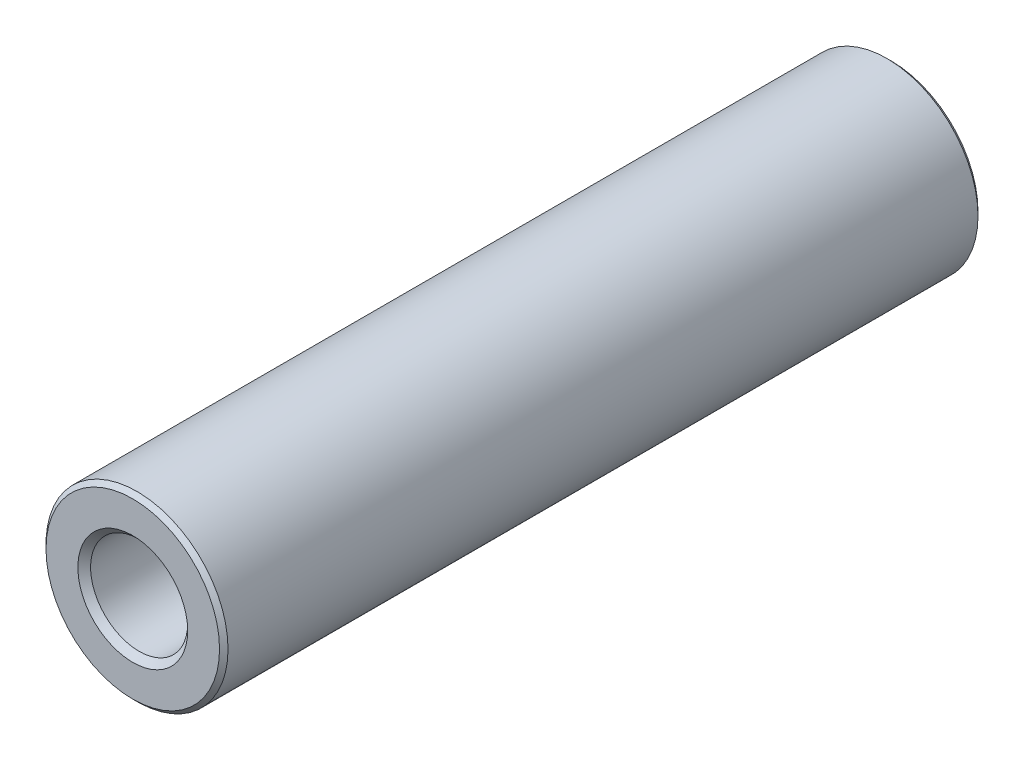
from build123d import *

# Parameters (mm, degrees)
BOSS_EXTRUDE1_DEPTH      = 12.5
BOSS_EXTRUDE1_DEPTH_BACK = 12.5
SKETCH3_R                = 3
SKETCH3_R_2              = 1.6
CHAMFER1_SIZE            = 0.14
CHAMFER2_SIZE            = 0.21


with BuildPart() as part:
    # Sketch3 → Boss-Extrude1 (new, two sides: drawn at the far end of the back side and taken through both)
    with BuildSketch(Plane.XY.offset(-BOSS_EXTRUDE1_DEPTH_BACK)):
        Circle(SKETCH3_R)
        Circle(SKETCH3_R_2, mode=Mode.SUBTRACT)
    extrude(amount=BOSS_EXTRUDE1_DEPTH + BOSS_EXTRUDE1_DEPTH_BACK)

    # Chamfer1
    chamfer1_edges = [part.edges().sort_by_distance(p)[0] for p in [
        (-3, 0, -12.5),
        (-3, 0, 12.5),
    ]]
    chamfer(chamfer1_edges, length=CHAMFER1_SIZE)

    # Chamfer2
    chamfer2_edges = [part.edges().sort_by_distance(p)[0] for p in [
        (-1.6, 0, -12.5),
        (-1.6, 0, 12.5),
    ]]
    chamfer(chamfer2_edges, length=CHAMFER2_SIZE)


solid = part.part
